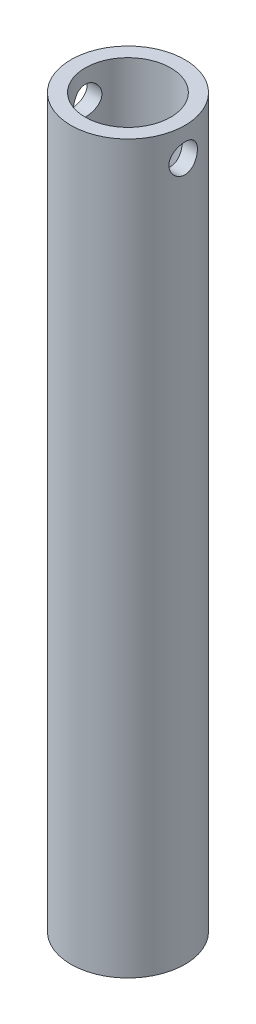
from build123d import *

# Parameters (mm, degrees)
SKETCH1_R               = 12.7
SKETCH1_R_2             = 9.525
BOSS_EXTRUDE1_DEPTH     = 161.925
CUT_EXTRUDE1_DEPTH      = 163.918033455
CUT_EXTRUDE1_DEPTH_BACK = 163.918033455
SKETCH2_R               = 3.175


with BuildPart() as part:
    # Sketch1 → Boss-Extrude1 (new body)
    with BuildSketch(Plane(origin=(0, 0, 0), x_dir=(1, 0, 0), z_dir=(0, 1, 0))):
        with Locations(Location((0, 0, 0), (0, 0, 270))):
            Circle(SKETCH1_R)
        with Locations(Location((0, 0, 0), (0, 0, 270))):
            Circle(SKETCH1_R_2, mode=Mode.SUBTRACT)
    extrude(amount=BOSS_EXTRUDE1_DEPTH)

    # Sketch2 → Cut-Extrude1 (cut, two sides: drawn at the far end of the back side and taken through both)
    with BuildSketch(Plane(origin=(0, 0, 0), x_dir=(0, 0, -1), z_dir=(1, 0, 0)).offset(-CUT_EXTRUDE1_DEPTH_BACK)):
        with Locations((0, 155.575)):
            Circle(SKETCH2_R)
    extrude(amount=CUT_EXTRUDE1_DEPTH + CUT_EXTRUDE1_DEPTH_BACK, mode=Mode.SUBTRACT)


solid = part.part
